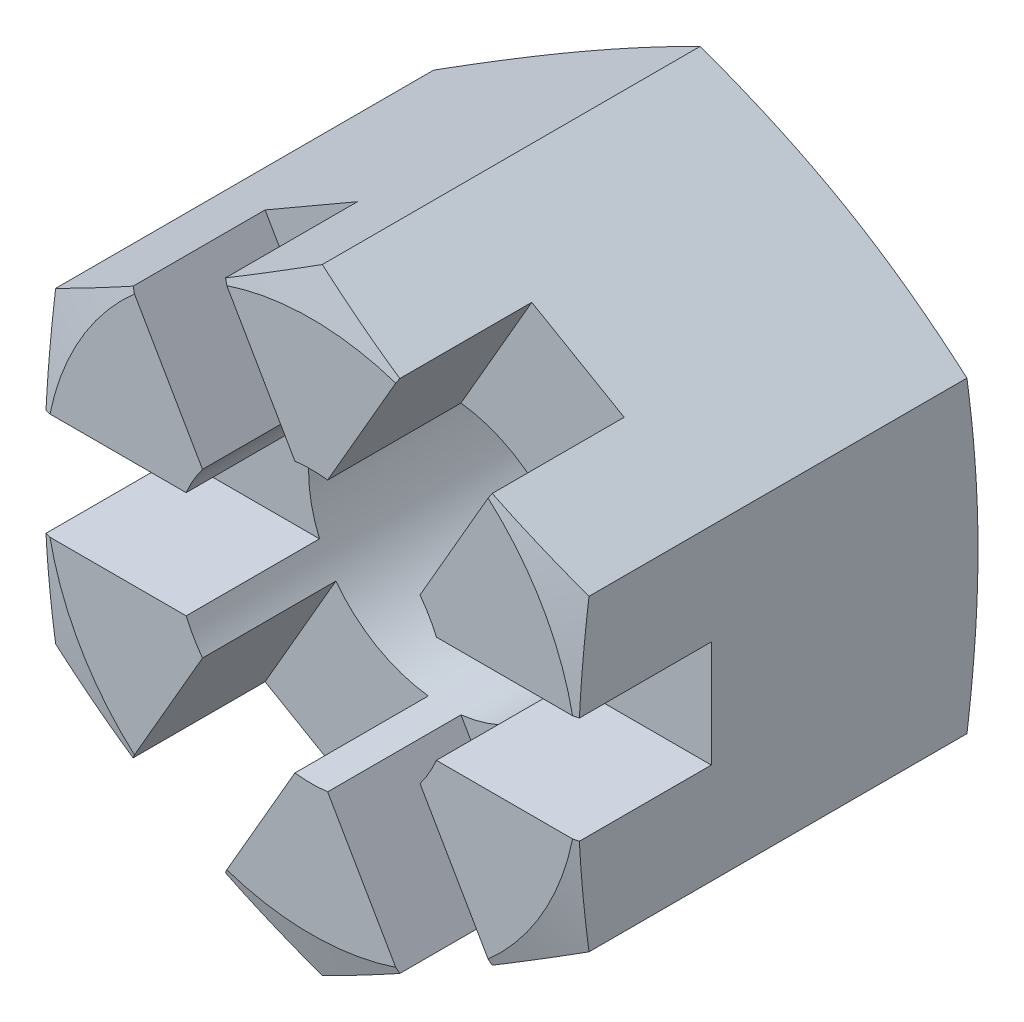
from build123d import *

# Parameters (mm, degrees)
VYSUNOUT1_DEPTH          = 7.5
SKICA4_R                 = 2.55
ODEBRAT_VYSUNUT_M1_DEPTH = 11.704360482
SKICA5_W                 = 10
SKICA5_H                 = 2
ODEBRAT_VYSUNUT_M2_DEPTH = 2.5
KRUHOV_POLE1_COUNT       = 3
ZKOSIT1_SIZE             = 0.6
ZKOSIT1_SIZE2            = 0.346410162


with BuildPart() as part:
    # Skica1 → Vysunout1 (new body)
    with BuildSketch(Plane.XY):
        Polygon((5, -2.886751346), (5, 2.886751346), (0, 5.773502692), (-5, 2.886751346), (-5, -2.886751346), (0, -5.773502692), align=None)
    extrude(amount=VYSUNOUT1_DEPTH)

    # Skica3 → Odebrat otočením1 (revolve, cut)
    with BuildSketch(Plane(origin=(0, 0, 0), x_dir=(1, 0, 0), z_dir=(0, 1, 0))):
        Polygon((-18.995190528, -3.75), (-5, 0), (-18.995190528, 0), align=None)
        Polygon((-5, -7.5), (-18.995190528, -3.75), (-18.995190528, -7.5), align=None)
    revolve(axis=Axis((0, 0, 0), (0, 0, 1)), mode=Mode.SUBTRACT)

    # Skica4 → Odebrat vysunutím1 (cut, through all)
    with BuildSketch(Plane(origin=(0, 0, 0), x_dir=(-1, 0, 0), z_dir=(0, 0, -1))):
        Circle(SKICA4_R)
    extrude(amount=-ODEBRAT_VYSUNUT_M1_DEPTH, mode=Mode.SUBTRACT)

    # Skica5 → Odebrat vysunutím2 (cut)
    with BuildSketch(Plane.XY.offset(7.5)):
        Rectangle(SKICA5_W, SKICA5_H)
    odebrat_vysunut_m2 = extrude(amount=-ODEBRAT_VYSUNUT_M2_DEPTH, mode=Mode.SUBTRACT)

    # Kruhové pole1: Odebrat vysunutím2 ×3 about axis
    kruhov_pole1_axis = Axis((0, 0, 0), (0, 0, 1))
    for i in range(1, KRUHOV_POLE1_COUNT):
        add(odebrat_vysunut_m2.rotate(kruhov_pole1_axis, i * 360 / KRUHOV_POLE1_COUNT), mode=Mode.SUBTRACT)

    # Zkosit1
    zkosit1_edges = [part.edges().sort_by_distance(p)[0] for p in [
        (2.55, 0, 0),
    ]]
    zkosit1_side = [part.faces().sort_by_distance(p)[0] for p in [
        (4.207652448, -2.429289467, 0),
    ]]
    chamfer(zkosit1_edges, length=ZKOSIT1_SIZE, length2=ZKOSIT1_SIZE2, reference=zkosit1_side[0])


solid = part.part
